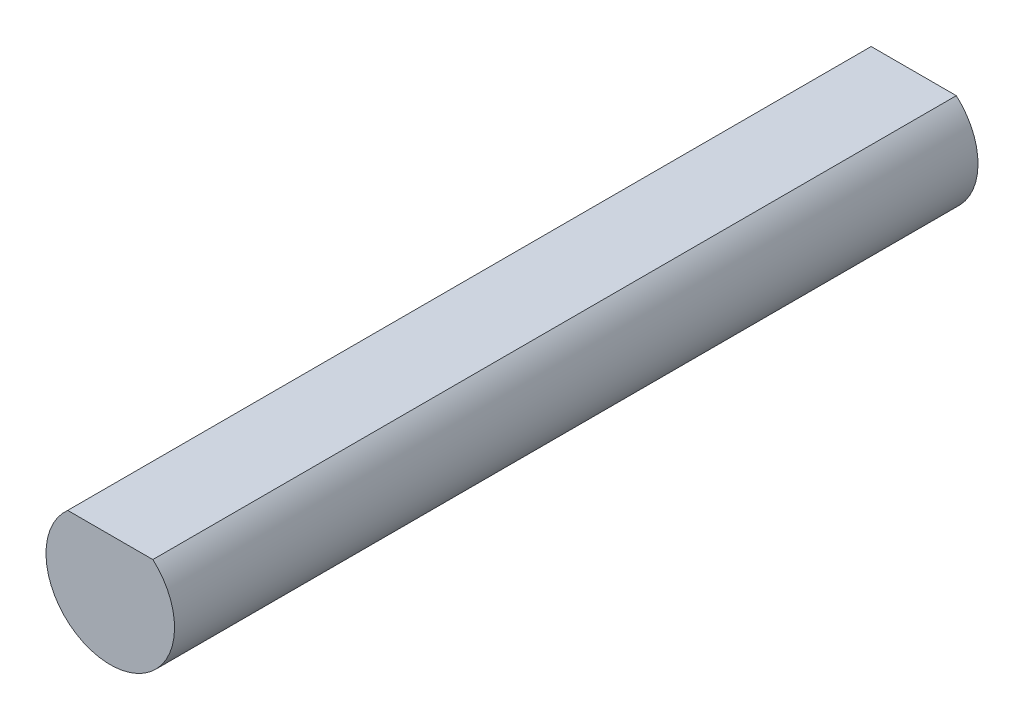
from build123d import *

# Parameters (mm, degrees)
BOSS_EXTRUDE1_DEPTH = 25


with BuildPart() as part:
    # Sketch1 → Boss-Extrude1 (new body)
    with BuildSketch(Plane.XY):
        with BuildLine():
            Line((-1.325, 1.498123827), (1.325, 1.498123827))
            ThreePointArc((1.325, 1.498123827), (0, -2), (-1.325, 1.498123827))
        make_face()
    extrude(amount=BOSS_EXTRUDE1_DEPTH)


solid = part.part
